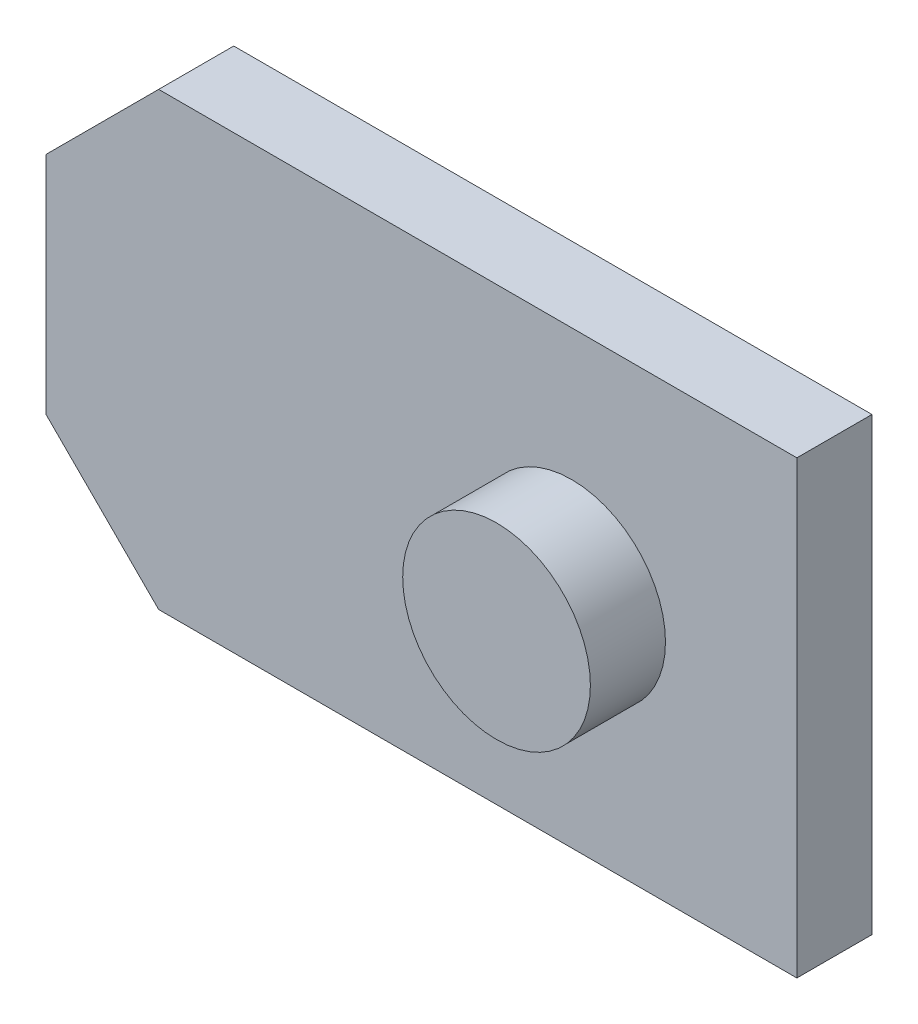
from build123d import *

# Parameters (mm, degrees)
BASE_SKETCH_R       = 12.5
BOSS_EXTRUDE1_DEPTH = 10
BASE_SKETCH_3_R     = 12.5
BOSS_EXTRUDE2_DEPTH = 20


with BuildPart() as part:
    # Base Sketch → Boss-Extrude1 (new body)
    with BuildSketch(Plane.XY):
        Polygon((-55, -30), (30, -30), (30, 30), (-55, 30), (-70, 15), (-70, -15), align=None)
        Circle(BASE_SKETCH_R, mode=Mode.SUBTRACT)
    extrude(amount=BOSS_EXTRUDE1_DEPTH)

    # Base Sketch<3> → Boss-Extrude2 (add)
    with BuildSketch(Plane.XY):
        Circle(BASE_SKETCH_3_R)
    extrude(amount=BOSS_EXTRUDE2_DEPTH)


solid = part.part
